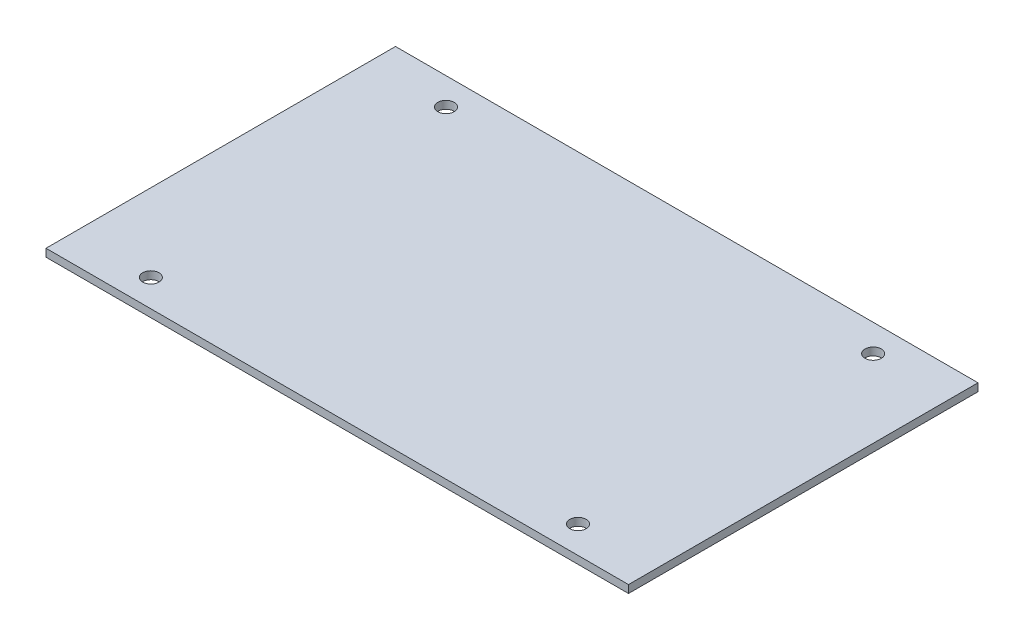
from build123d import *

# Parameters (mm, degrees)
SKETCH_1_W      = 150
SKETCH_1_H      = 90
SKETCH_1_R      = 2.1
EXTRUDE_1_DEPTH = 2


with BuildPart() as part:
    # 草图1 → 凸台-拉伸1 (new body)
    with BuildSketch(Plane(origin=(0, 0, 0), x_dir=(1, 0, 0), z_dir=(0, 1, 0))):
        Rectangle(SKETCH_1_W, SKETCH_1_H)
        with Locations(Location((-55, 38, 0), (0, 0, 270))):
            Circle(SKETCH_1_R, mode=Mode.SUBTRACT)
        with Locations(Location((55, 38, 0), (0, 0, 270))):
            Circle(SKETCH_1_R, mode=Mode.SUBTRACT)
        with Locations(Location((-55, -38, 0), (0, 0, 270))):
            Circle(SKETCH_1_R, mode=Mode.SUBTRACT)
        with Locations(Location((55, -38, 0), (0, 0, 270))):
            Circle(SKETCH_1_R, mode=Mode.SUBTRACT)
    extrude(amount=EXTRUDE_1_DEPTH)


solid = part.part
